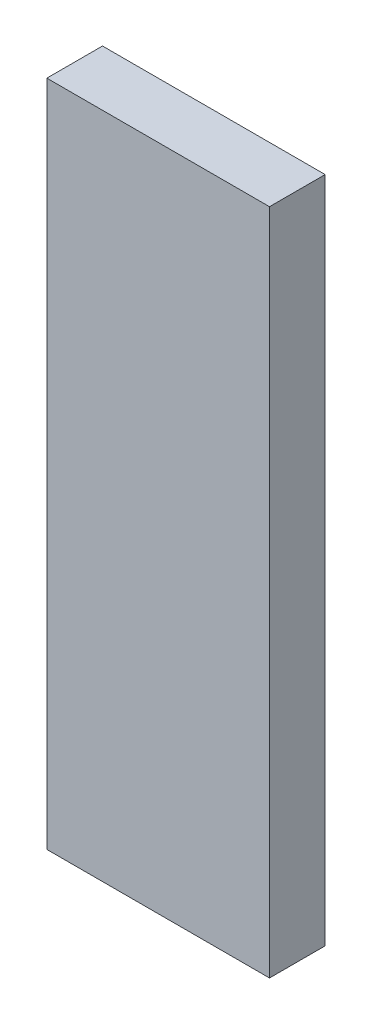
from build123d import *

# Parameters (mm, degrees)
SKETCH1_W           = 50.8
SKETCH1_H           = 12.7
BOSS_EXTRUDE1_DEPTH = 152.4


with BuildPart() as part:
    # Sketch1 → Boss-Extrude1 (new body)
    with BuildSketch(Plane(origin=(0, 0, 0), x_dir=(1, 0, 0), z_dir=(0, 1, 0))):
        with Locations((25.4, 6.35)):
            Rectangle(SKETCH1_W, SKETCH1_H)
    extrude(amount=BOSS_EXTRUDE1_DEPTH)


solid = part.part
